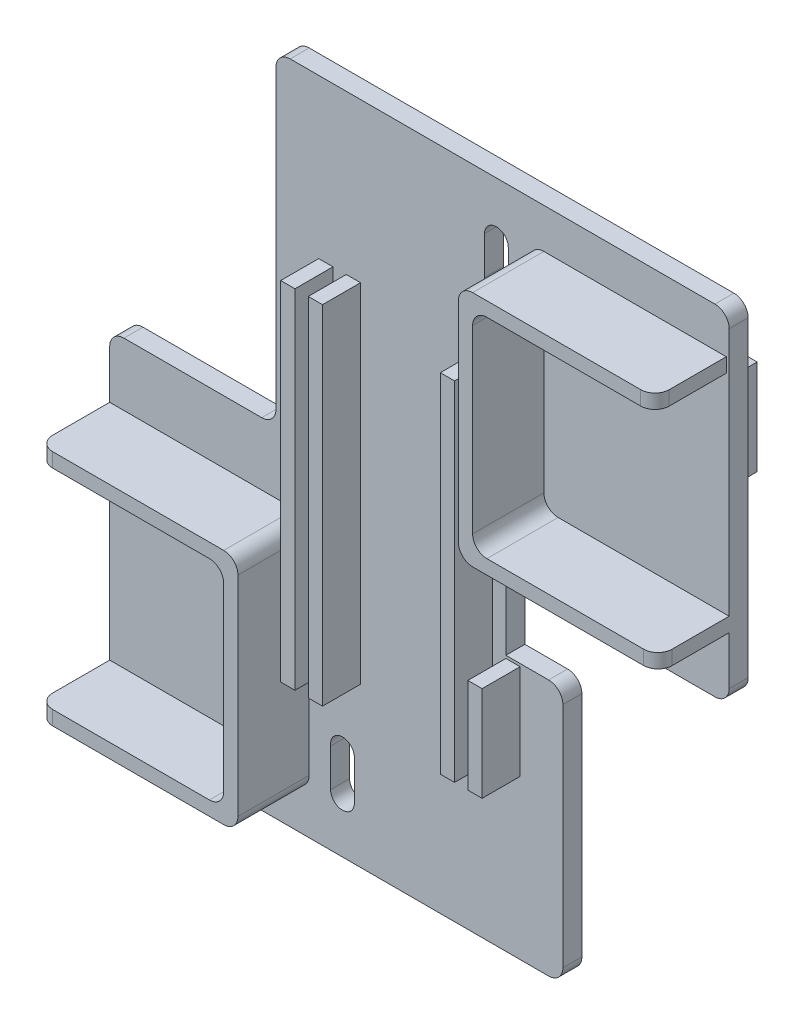
from build123d import *

# Parameters (mm, degrees)
SKETCH3_W             = 1.5
SKETCH3_H             = 36.6
BOSS_EXTRUDE1_DEPTH   = 4
BOSS_EXTRUDE1_2_DEPTH = 4
BOSS_EXTRUDE1_3_DEPTH = 4
BOSS_EXTRUDE1_4_DEPTH = 4
SKETCH4_W             = 65.2
SKETCH4_H             = 70
BOSS_EXTRUDE2_DEPTH   = 2
BOSS_EXTRUDE3_DEPTH   = 7.5
SKETCH6_W             = 17.5
SKETCH6_H             = 29.2
CUT_EXTRUDE1_DEPTH    = 4
SKETCH10_R            = 1.5
CUT_EXTRUDE5_DEPTH    = 20
SKETCH11_W            = 23.629808973
SKETCH11_H            = 13.794178538
SKETCH11_W_2          = 19.491555411
SKETCH11_H_2          = 12.733087881
CUT_EXTRUDE6_DEPTH    = 20
SKETCH13_W            = 4
SKETCH13_H            = 16.6
CUT_EXTRUDE7_DEPTH    = 2
SKETCH15_W            = 6
SKETCH15_H            = 11.6
CUT_EXTRUDE8_DEPTH    = 2
CUT_EXTRUDE9_DEPTH    = 2
FILLET1_R             = 1.5
CUT_EXTRUDE11_DEPTH   = 2
FILLET2_R             = 1.5
SKETCH19_W            = 10
SKETCH19_H            = 10
BOSS_EXTRUDE5_DEPTH   = 4.95


with BuildPart() as part:
    # Sketch3 → Boss-Extrude1 (new body)
    with BuildSketch(Plane.XY):
        with Locations((-6.95, 0)):
            Rectangle(SKETCH3_W, SKETCH3_H)
    extrude(amount=BOSS_EXTRUDE1_DEPTH)



with BuildPart() as body_2:
    # Sketch3 → Boss-Extrude1 2 (new body)
    with BuildSketch(Plane.XY):
        with Locations((-9.85, 0)):
            Rectangle(SKETCH3_W, SKETCH3_H)
    extrude(amount=BOSS_EXTRUDE1_2_DEPTH)


with BuildPart() as body_3:
    # Sketch3 → Boss-Extrude1 3 (new body)
    with BuildSketch(Plane.XY):
        with Locations((6.95, 0)):
            Rectangle(SKETCH3_W, SKETCH3_H)
    extrude(amount=BOSS_EXTRUDE1_3_DEPTH)


with BuildPart() as body_4:
    # Sketch3 → Boss-Extrude1 4 (new body)
    with BuildSketch(Plane.XY):
        with Locations((9.85, 0)):
            Rectangle(SKETCH3_W, SKETCH3_H)
    extrude(amount=BOSS_EXTRUDE1_4_DEPTH)


with BuildPart() as part_1:
    add(part.part)

    add(body_2.part)  # Boss-Extrude2 merges body 2

    add(body_3.part)  # Boss-Extrude2 merges body 3

    add(body_4.part)  # Boss-Extrude2 merges body 4
    # Sketch4 → Boss-Extrude2 (add)
    with BuildSketch(Plane.XY):
        Rectangle(SKETCH4_W, SKETCH4_H)
    extrude(amount=-BOSS_EXTRUDE2_DEPTH)

    # Sketch5 → Boss-Extrude3 (add)
    with BuildSketch(Plane.XY):
        Polygon((11.6, 30.8), (11.6, 5.8), (32.6, 5.8), (32.6, 7.3), (13.1, 7.3), (13.1, 29.3), (32.294650231, 29.3), (32.294650231, 30.8), align=None)
        Polygon((-32.6, -5.8), (-11.6, -5.8), (-11.6, -30.8), (-32.6, -30.8), (-32.6, -29.3), (-13.1, -29.3), (-13.1, -7.3), (-32.6, -7.3), align=None)
    extrude(amount=BOSS_EXTRUDE3_DEPTH)

    # Sketch6 → Cut-Extrude1 (cut)
    with BuildSketch(Plane.XY):
        with Locations((-23.85, 15.4)):
            Rectangle(SKETCH6_W, SKETCH6_H)
        with Locations((23.85, -15.4)):
            Rectangle(SKETCH6_W, SKETCH6_H)
    extrude(amount=-CUT_EXTRUDE1_DEPTH, mode=Mode.SUBTRACT)

    # Sketch10 → Cut-Extrude5 (cut)
    with BuildSketch(Plane(origin=(0, 0, -2), x_dir=(-1, 0, 0), z_dir=(0, 0, -1))):
        with Locations((-15.1, 27.3)):
            Circle(SKETCH10_R)
        with Locations((15.1, -27.3)):
            Circle(SKETCH10_R)
    extrude(amount=-CUT_EXTRUDE5_DEPTH, mode=Mode.SUBTRACT)

    # Sketch11 → Cut-Extrude6 (cut)
    with BuildSketch(Plane.XY):
        with Locations((-26.914904487, 32.734646762)):
            Rectangle(SKETCH11_W, SKETCH11_H)
        with Locations((24.845777706, -31.885774236)):
            Rectangle(SKETCH11_W_2, SKETCH11_H_2)
    extrude(amount=-CUT_EXTRUDE6_DEPTH, mode=Mode.SUBTRACT)

    # Sketch13 → Cut-Extrude7 (cut)
    with BuildSketch(Plane(origin=(10.6, 0, 0), x_dir=(0, 0, -1), z_dir=(1, 0, 0))):
        with Locations((-2, 0)):
            Rectangle(SKETCH13_W, SKETCH13_H)
    extrude(amount=-CUT_EXTRUDE7_DEPTH, mode=Mode.SUBTRACT)

    # Sketch15 → Cut-Extrude8 (cut)
    with BuildSketch(Plane.XY):
        with Locations((12.1, 0)):
            Rectangle(SKETCH15_W, SKETCH15_H)
    extrude(amount=-CUT_EXTRUDE8_DEPTH, mode=Mode.SUBTRACT)

    # Sketch16 → Cut-Extrude9 (cut)
    with BuildSketch(Plane.XY):
        with BuildLine():
            Line((-6.85, -25.3), (-6.85, -29.480622793))
            ThreePointArc((-6.85, -29.480622793), (-8.1, -30.730622793), (-9.35, -29.480622793))
            Line((-9.35, -29.480622793), (-9.33687818, -25.480644316))
            ThreePointArc((-9.33687818, -25.480644316), (-8.190560134, -24.053284771), (-6.85, -25.3))
        make_face()
        with BuildLine():
            Line((6.85, 29.3), (6.85, 25.3))
            ThreePointArc((6.85, 25.3), (8.1, 24.05), (9.35, 25.3))
            Line((9.35, 25.3), (9.35, 29.3))
            ThreePointArc((9.35, 29.3), (8.1, 30.55), (6.85, 29.3))
        make_face()
    extrude(amount=-CUT_EXTRUDE9_DEPTH, mode=Mode.SUBTRACT)

    # Fillet1
    fillet1_edges = [part_1.edges().sort_by_distance(p)[0] for p in [
        (32.6, 6.55, 7.5),
        (32.294650231, 30.05, 7.5),
        (-13.1, -7.3, 3.75),
        (-13.1, -29.3, 3.75),
        (-11.6, -30.8, 3.75),
        (-11.6, -5.8, 3.75),
        (-32.6, -6.55, 7.5),
        (-32.6, -30.05, 7.5),
        (-32.6, 0.8, -1),
        (-15.1, 0.8, -1),
        (32.6, -0.8, -1),
        (15.1, -0.8, -1),
        (-15.1, 35, -1),
        (15.1, -35, -1),
        (15.1, 5.8, -1),
        (15.1, -5.8, -1),
        (32.6, 35, -1),
        (-32.6, -35, -1),
        (11.6, 30.8, 3.75),
        (11.6, 5.8, 3.75),
        (13.1, 7.3, 3.75),
        (13.1, 29.3, 3.75),
    ]]
    fillet(fillet1_edges, radius=FILLET1_R)

    # Sketch18 → Cut-Extrude11 (cut)
    with BuildSketch(Plane.XY):
        Polygon((9.1, 8.3), (11.6, 8.3), (11.6, -5.8), (16.495460275, -5.8), (16.495460275, -8.011234459), (9.1, -8.011234459), align=None)
    extrude(amount=-CUT_EXTRUDE11_DEPTH, mode=Mode.SUBTRACT)

    # Fillet2
    fillet2_edges = [part_1.edges().sort_by_distance(p)[0] for p in [
        (11.6, 5.8, -1),
        (15.1, -8.011234459, -1),
    ]]
    fillet(fillet2_edges, radius=FILLET2_R)

    # Sketch19 → Boss-Extrude5 (add)
    with BuildSketch(Plane(origin=(0, 0, -2), x_dir=(-1, 0, 0), z_dir=(0, 0, -1))):
        with Locations((-23.6, 20)):
            Rectangle(SKETCH19_W, SKETCH19_H)
        with Locations((23.6, -20)):
            Rectangle(SKETCH19_W, SKETCH19_H)
    extrude(amount=BOSS_EXTRUDE5_DEPTH)


solid = part_1.part
